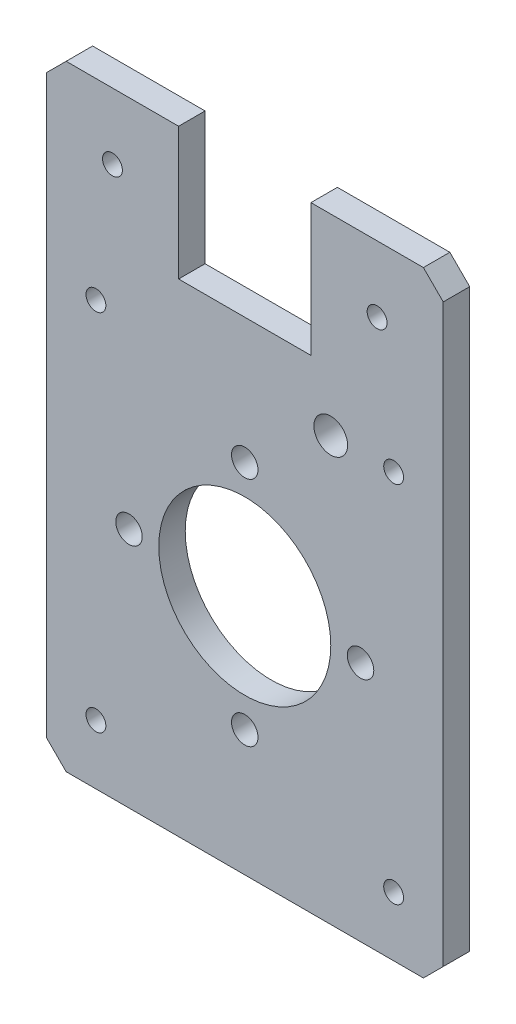
from build123d import *

# Parameters (mm, degrees)
SKETCH1_W           = 60
SKETCH1_H           = 73
BOSS_EXTRUDE1_DEPTH = 6
SKETCH2_R           = 8
CUT_EXTRUDE1_DEPTH  = 95.683683917
SKETCH3_R           = 1.5
CUT_EXTRUDE2_DEPTH  = 95.683683917
SKETCH4_R           = 21
CUT_EXTRUDE3_DEPTH  = 4
SKETCH5_W           = 20
SKETCH5_H           = 20
BOSS_EXTRUDE2_DEPTH = 6
SKETCH6_R           = 1.5
CUT_EXTRUDE4_DEPTH  = 10
CHAMFER1_SIZE       = 3
CHAMFER2_SIZE       = 3
SKETCH7_R           = 2
CUT_EXTRUDE5_DEPTH  = 111.747460467
SKETCH8_R           = 13
CUT_EXTRUDE6_DEPTH  = 111.747460467
BOSS_EXTRUDE3_START = 4
SKETCH9_R           = 21
SKETCH9_R_2         = 2
SKETCH9_R_3         = 13
BOSS_EXTRUDE3_DEPTH = 4
CUT_EXTRUDE7_DEPTH  = 2
SKETCH12_R          = 2.55
CUT_EXTRUDE8_DEPTH  = 10


with BuildPart() as part:
    # Sketch1 → Boss-Extrude1 (new body)
    with BuildSketch(Plane.XY):
        with Locations((30, 36.5)):
            Rectangle(SKETCH1_W, SKETCH1_H)
    extrude(amount=BOSS_EXTRUDE1_DEPTH)

    # Sketch2 → Cut-Extrude1 (cut, through all)
    with BuildSketch(Plane(origin=(0, 0, 0), x_dir=(-1, 0, 0), z_dir=(0, 0, -1))):
        with Locations((-30, 36.5)):
            Circle(SKETCH2_R)
    extrude(amount=-CUT_EXTRUDE1_DEPTH, mode=Mode.SUBTRACT)

    # Sketch3 → Cut-Extrude2 (cut, through all)
    with BuildSketch(Plane(origin=(0, 0, 0), x_dir=(-1, 0, 0), z_dir=(0, 0, -1))):
        with Locations((-52.5, 64)):
            Circle(SKETCH3_R)
        with Locations((-7.5, 64)):
            Circle(SKETCH3_R)
        with Locations((-52.5, 9)):
            Circle(SKETCH3_R)
        with Locations((-7.5, 9)):
            Circle(SKETCH3_R)
    extrude(amount=-CUT_EXTRUDE2_DEPTH, mode=Mode.SUBTRACT)

    # Sketch4 → Cut-Extrude3 (cut)
    with BuildSketch(Plane(origin=(0, 0, 0), x_dir=(-1, 0, 0), z_dir=(0, 0, -1))):
        with Locations((-30, 36.5)):
            Circle(SKETCH4_R)
    extrude(amount=-CUT_EXTRUDE3_DEPTH, mode=Mode.SUBTRACT)

    # Sketch5 → Boss-Extrude2 (add)
    with BuildSketch(Plane(origin=(0, 0, 0), x_dir=(-1, 0, 0), z_dir=(0, 0, -1))):
        with Locations((-50, 83)):
            Rectangle(SKETCH5_W, SKETCH5_H)
        with Locations((-10, 83)):
            Rectangle(SKETCH5_W, SKETCH5_H)
    extrude(amount=-BOSS_EXTRUDE2_DEPTH)

    # Sketch6 → Cut-Extrude4 (cut)
    with BuildSketch(Plane(origin=(0, 0, 0), x_dir=(-1, 0, 0), z_dir=(0, 0, -1))):
        with Locations((-10, 83)):
            Circle(SKETCH6_R)
        with Locations((-50, 83)):
            Circle(SKETCH6_R)
    extrude(amount=-CUT_EXTRUDE4_DEPTH, mode=Mode.SUBTRACT)

    # Chamfer1
    chamfer1_edges = [part.edges().sort_by_distance(p)[0] for p in [
        (60, 0, 3),
        (0, 0, 3),
    ]]
    chamfer(chamfer1_edges, length=CHAMFER1_SIZE)

    # Chamfer2
    chamfer2_edges = [part.edges().sort_by_distance(p)[0] for p in [
        (60, 93, 3),
        (0, 93, 3),
    ]]
    chamfer(chamfer2_edges, length=CHAMFER2_SIZE)

    # Sketch7 → Cut-Extrude5 (cut, through all)
    with BuildSketch(Plane(origin=(0, 0, 4), x_dir=(-1, 0, 0), z_dir=(0, 0, -1))):
        with Locations((-30, 54)):
            Circle(SKETCH7_R)
        with Locations((-12.5, 36.5)):
            Circle(SKETCH7_R)
        with Locations((-30, 19)):
            Circle(SKETCH7_R)
        with Locations((-47.5, 36.5)):
            Circle(SKETCH7_R)
    extrude(amount=-CUT_EXTRUDE5_DEPTH, mode=Mode.SUBTRACT)

    # Sketch8 → Cut-Extrude6 (cut, through all)
    with BuildSketch(Plane(origin=(0, 0, 4), x_dir=(-1, 0, 0), z_dir=(0, 0, -1))):
        with Locations((-30, 36.5)):
            Circle(SKETCH8_R)
    extrude(amount=-CUT_EXTRUDE6_DEPTH, mode=Mode.SUBTRACT)

    # Sketch9 → Boss-Extrude3 (add)
    with BuildSketch(Plane(origin=(0, 0, 4), x_dir=(-1, 0, 0), z_dir=(0, 0, -1)).offset(BOSS_EXTRUDE3_START)):
        with Locations((-30, 36.5)):
            Circle(SKETCH9_R)
        with Locations((-30, 54)):
            Circle(SKETCH9_R_2, mode=Mode.SUBTRACT)
        with Locations((-30, 19)):
            Circle(SKETCH9_R_2, mode=Mode.SUBTRACT)
        with Locations((-47.5, 36.5)):
            Circle(SKETCH9_R_2, mode=Mode.SUBTRACT)
        with Locations((-12.5, 36.5)):
            Circle(SKETCH9_R_2, mode=Mode.SUBTRACT)
        with Locations((-30, 36.5)):
            Circle(SKETCH9_R_3, mode=Mode.SUBTRACT)
    extrude(amount=-BOSS_EXTRUDE3_DEPTH)

    # Sketch11 → Cut-Extrude7 (cut)
    with BuildSketch(Plane.XY.offset(6)):
        Polygon((60, 3), (60, 90), (57, 93), (40, 93), (40, 73), (20, 73), (20, 93), (3, 93), (0, 90), (0, 3), (3, 0), (57, 0), align=None)
    extrude(amount=-CUT_EXTRUDE7_DEPTH, mode=Mode.SUBTRACT)

    # Sketch12 → Cut-Extrude8 (cut)
    with BuildSketch(Plane.XY.offset(4)):
        with Locations((43, 64)):
            Circle(SKETCH12_R)
    extrude(amount=-CUT_EXTRUDE8_DEPTH, mode=Mode.SUBTRACT)


solid = part.part
